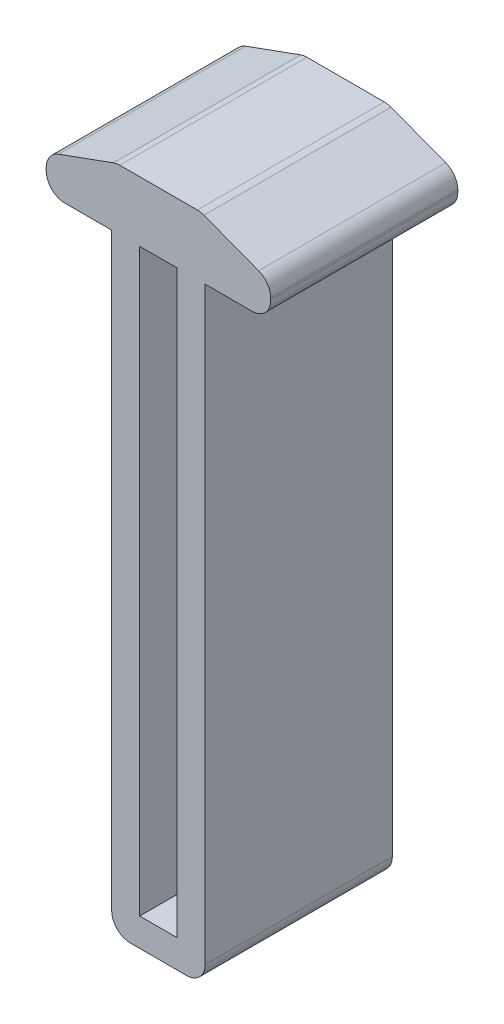
from build123d import *

# Parameters (mm, degrees)
ESQUISSE1_W        = 2
ESQUISSE1_H        = 31
BOSS_EXTRU_1_DEPTH = 10
CONG_1_R           = 1


with BuildPart() as part:
    # Esquisse1 → Boss.-Extru.1 (new body)
    with BuildSketch(Plane.XY):
        Polygon((10.551419921, 0), (10.551419921, 1.805779869), (6.81110646, 3.223544029), (2.31110646, 3.223544029), (-1.448580079, 1.857982926), (-1.448580079, 0), (2.051419921, 0), (2.051419921, -32.5), (7.051419921, -32.5), (7.051419921, 0), align=None)
        with Locations((4.551419921, -15.5)):
            Rectangle(ESQUISSE1_W, ESQUISSE1_H, mode=Mode.SUBTRACT)
    extrude(amount=BOSS_EXTRU_1_DEPTH)

    # Congé1
    cong_1_edges = [part.edges().sort_by_distance(p)[0] for p in [
        (-1.448580079, 0, 5),
        (-1.448580079, 1.857982926, 5),
        (2.31110646, 3.223544029, 5),
        (6.81110646, 3.223544029, 5),
        (10.551419921, 1.805779869, 5),
        (10.551419921, 0, 5),
        (7.051419921, -32.5, 5),
        (2.051419921, -32.5, 5),
    ]]
    fillet(cong_1_edges, radius=CONG_1_R)


solid = part.part
